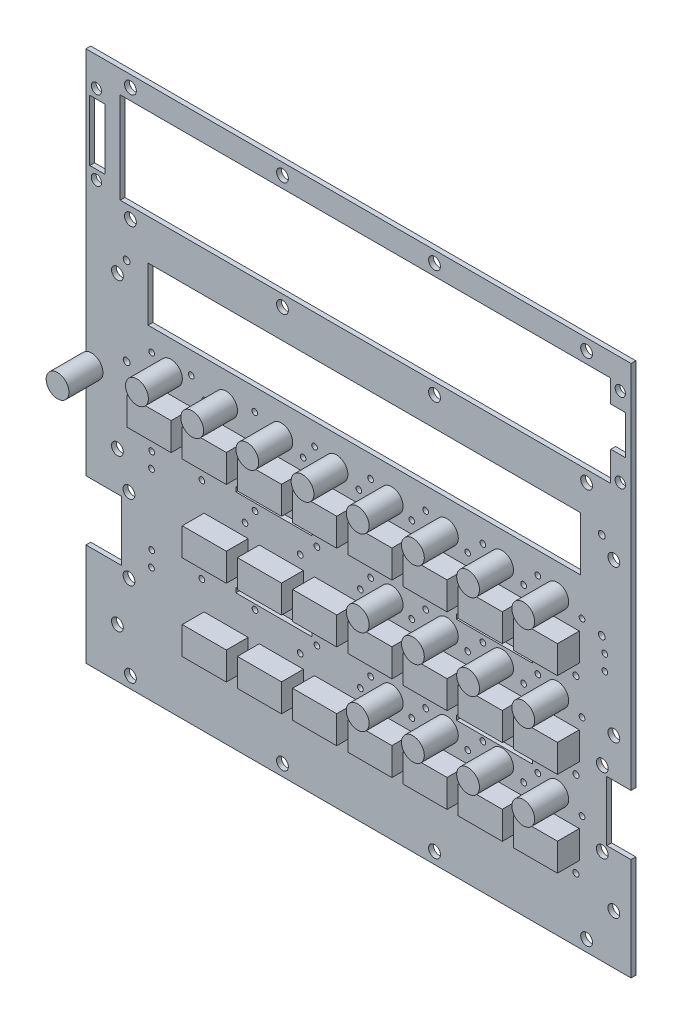
from build123d import *

# Parameters (mm, degrees)
SKETCH1_W                       = 144.56156
SKETCH1_H                       = 18.00098
SKETCH1_W_2                     = 5.08
SKETCH1_H_2                     = 20.32
SKETCH1_W_3                     = 25.4
SKETCH1_H_3                     = 1.5875
BOARD_DEPTH                     = 1.592072
SKETCH2_R                       = 3.81
LED_KINGBRIGHT_3P_2P54_1_DEPTH  = 11.3538
SKETCH3_R                       = 3.81
LED_KINGBRIGHT_3P_2P54_2_DEPTH  = 11.3538
SKETCH4_R                       = 3.81
LED_KINGBRIGHT_3P_2P54_3_DEPTH  = 11.3538
SKETCH5_R                       = 3.81
LED_KINGBRIGHT_3P_2P54_4_DEPTH  = 11.3538
SKETCH6_R                       = 3.81
LED_KINGBRIGHT_3P_2P54_5_DEPTH  = 11.3538
SKETCH7_R                       = 3.81
LED_KINGBRIGHT_3P_2P54_6_DEPTH  = 11.3538
SKETCH8_R                       = 3.81
LED_KINGBRIGHT_3P_2P54_7_DEPTH  = 11.3538
SKETCH9_R                       = 3.81
LED_KINGBRIGHT_3P_2P54_8_DEPTH  = 11.3538
SKETCH10_R                      = 3.81
LED_KINGBRIGHT_3P_2P54_9_DEPTH  = 11.3538
SKETCH19_R                      = 3.81
LED_KINGBRIGHT_3P_2P54_18_DEPTH = 11.3538
SKETCH20_R                      = 3.81
LED_KINGBRIGHT_3P_2P54_19_DEPTH = 11.3538
SKETCH21_R                      = 3.81
LED_KINGBRIGHT_3P_2P54_20_DEPTH = 11.3538
SKETCH22_R                      = 3.81
LED_KINGBRIGHT_3P_2P54_21_DEPTH = 11.3538
SKETCH23_R                      = 3.81
LED_KINGBRIGHT_3P_2P54_22_DEPTH = 11.3538
SKETCH24_R                      = 3.81
LED_KINGBRIGHT_3P_2P54_23_DEPTH = 11.3538
SKETCH25_R                      = 3.81
LED_KINGBRIGHT_3P_2P54_24_DEPTH = 11.3538
SKETCH26_R                      = 3.81
LED_KINGBRIGHT_3P_2P54_25_DEPTH = 11.3538
SKETCH27_W                      = 14.732
SKETCH27_H                      = 9.271
SWITCH_MCDTS2_1_DEPTH           = 7.3000108
SKETCH28_W                      = 14.732
SKETCH28_H                      = 9.271
SWITCH_MCDTS2_2_DEPTH           = 7.3000108
SKETCH29_W                      = 14.732
SKETCH29_H                      = 9.271
SWITCH_MCDTS2_3_DEPTH           = 7.3000108
SKETCH30_W                      = 14.732
SKETCH30_H                      = 9.271
SWITCH_MCDTS2_4_DEPTH           = 7.3000108
SKETCH31_W                      = 14.732
SKETCH31_H                      = 9.271
SWITCH_MCDTS2_5_DEPTH           = 7.3000108
SKETCH32_W                      = 14.732
SKETCH32_H                      = 9.271
SWITCH_MCDTS2_6_DEPTH           = 7.3000108
SKETCH33_W                      = 14.732
SKETCH33_H                      = 9.271
SWITCH_MCDTS2_7_DEPTH           = 7.3000108
SKETCH34_W                      = 14.732
SKETCH34_H                      = 9.271
SWITCH_MCDTS2_8_DEPTH           = 7.3000108
SKETCH36_W                      = 14.732
SKETCH36_H                      = 9.271
SWITCH_MCDTS2_10_DEPTH          = 7.3000108
SKETCH37_W                      = 14.732
SKETCH37_H                      = 9.271
SWITCH_MCDTS2_11_DEPTH          = 7.3000108
SKETCH38_W                      = 14.732
SKETCH38_H                      = 9.271
SWITCH_MCDTS2_12_DEPTH          = 7.3000108
SKETCH39_W                      = 14.732
SKETCH39_H                      = 9.271
SWITCH_MCDTS2_13_DEPTH          = 7.3000108
SKETCH40_W                      = 14.732
SKETCH40_H                      = 9.271
SWITCH_MCDTS2_14_DEPTH          = 7.3000108
SKETCH41_W                      = 14.732
SKETCH41_H                      = 9.271
SWITCH_MCDTS2_15_DEPTH          = 7.3000108
SKETCH43_W                      = 14.732
SKETCH43_H                      = 9.271
SWITCH_MCDTS2_17_DEPTH          = 7.3000108
SKETCH44_W                      = 14.732
SKETCH44_H                      = 9.271
SWITCH_MCDTS2_18_DEPTH          = 7.3000108
SKETCH45_W                      = 14.732
SKETCH45_H                      = 9.271
SWITCH_MCDTS2_19_DEPTH          = 7.3000108
SKETCH46_W                      = 14.732
SKETCH46_H                      = 9.271
SWITCH_MCDTS2_20_DEPTH          = 7.3000108
SKETCH47_W                      = 14.732
SKETCH47_H                      = 9.271
SWITCH_MCDTS2_21_DEPTH          = 7.3000108
SKETCH48_W                      = 14.732
SKETCH48_H                      = 9.271
SWITCH_MCDTS2_22_DEPTH          = 7.3000108
SKETCH49_W                      = 14.732
SKETCH49_H                      = 9.271
SWITCH_MCDTS2_23_DEPTH          = 7.3000108
SKETCH50_W                      = 14.732
SKETCH50_H                      = 9.271
SWITCH_MCDTS2_24_DEPTH          = 7.3000108
SKETCH56_R                      = 1.016
SKETCH56_R_2                    = 0.9652
SKETCH56_R_3                    = 0.9525
SKETCH56_R_4                    = 1.9685
SKETCH56_R_5                    = 1.1303
SKETCH56_R_6                    = 1.7145
CUT_EXTRUDE1_DEPTH              = 10


with BuildPart() as part:
    # Sketch1 → BOARD (new body)
    with BuildSketch(Plane.XY):
        Polygon((0, 0), (182.118, 0), (182.118, 34.24682), (173.98746, 34.24682), (173.98746, 54.24678), (182.118, 54.24678), (182.118, 177.8), (0, 177.8), (0, 54.24678), (11.86942, 54.24678), (11.86942, 34.24682), (0, 34.24682), align=None)
        with Locations((93.01988, 117.17909)):
            Rectangle(SKETCH1_W, SKETCH1_H, mode=Mode.SUBTRACT)
        with Locations((3.81, 154.813)):
            Rectangle(SKETCH1_W_2, SKETCH1_H_2, mode=Mode.SUBTRACT)
        Polygon((12.7, 170.18), (175.26, 170.18), (175.26, 162.6616), (180.086, 162.6616), (180.2892, 162.4584), (180.2892, 149.606), (175.3616, 149.606), (175.26, 149.5044), (175.26, 139.7), (12.7, 139.7), (11.43, 139.7), (11.43, 170.18), align=None, mode=Mode.SUBTRACT)
        with Locations((62.7634, 46.20895)):
            Rectangle(SKETCH1_W_3, SKETCH1_H_3, mode=Mode.SUBTRACT)
        with Locations((136.5134176, 46.20895)):
            Rectangle(SKETCH1_W_3, SKETCH1_H_3, mode=Mode.SUBTRACT)
        with Locations((136.5134176, 75.41895)):
            Rectangle(SKETCH1_W_3, SKETCH1_H_3, mode=Mode.SUBTRACT)
        with Locations((62.7634, 75.41895)):
            Rectangle(SKETCH1_W_3, SKETCH1_H_3, mode=Mode.SUBTRACT)
    extrude(amount=BOARD_DEPTH)

    # Sketch56 → Cut-Extrude1 (cut)
    with BuildSketch(Plane.XY.offset(1.592072)):
        with Locations((163.703, 21.1074)):
            Circle(SKETCH56_R)
        with Locations((163.703, 49.6824)):
            Circle(SKETCH56_R)
        with Locations((145.2626, 21.8186)):
            Circle(SKETCH56_R_2)
        with Locations((126.8476, 21.6154)):
            Circle(SKETCH56_R_2)
        with Locations((108.4072, 21.7424)):
            Circle(SKETCH56_R_2)
        with Locations((89.9668, 21.844)):
            Circle(SKETCH56_R_2)
        with Locations((71.5264, 20.7772)):
            Circle(SKETCH56_R_2)
        with Locations((53.086, 21.1582)):
            Circle(SKETCH56_R_2)
        with Locations((34.6472002, 21.1328)):
            Circle(SKETCH56_R)
        with Locations((145.2626, 49.5554)):
            Circle(SKETCH56_R)
        with Locations((126.8222, 49.3522)):
            Circle(SKETCH56_R)
        with Locations((108.3818, 49.1236)):
            Circle(SKETCH56_R)
        with Locations((89.9414, 49.6824)):
            Circle(SKETCH56_R)
        with Locations((71.501, 49.1998)):
            Circle(SKETCH56_R)
        with Locations((53.0606, 49.1998)):
            Circle(SKETCH56_R)
        with Locations((34.6202, 49.276)):
            Circle(SKETCH56_R)
        with Locations((163.703, 78.2574)):
            Circle(SKETCH56_R)
        with Locations((145.2626, 77.7748)):
            Circle(SKETCH56_R)
        with Locations((126.746, 78.3336)):
            Circle(SKETCH56_R)
        with Locations((108.3818, 78.74)):
            Circle(SKETCH56_R)
        with Locations((89.9414, 78.3336)):
            Circle(SKETCH56_R)
        with Locations((71.501, 78.2574)):
            Circle(SKETCH56_R)
        with Locations((53.0606, 78.4098)):
            Circle(SKETCH56_R)
        with Locations((34.6202, 78.0542)):
            Circle(SKETCH56_R)
        with Locations((91.694, 38.6588)):
            Circle(SKETCH56_R_3)
        with Locations((77.1652, 43.7388)):
            Circle(SKETCH56_R_3)
        with Locations((71.5772, 38.6588)):
            Circle(SKETCH56_R_3)
        with Locations((56.4896, 43.7388)):
            Circle(SKETCH56_R_3)
        with Locations((38.735, 43.7388)):
            Circle(SKETCH56_R_3)
        with Locations((21.8948, 38.6588)):
            Circle(SKETCH56_R_3)
        with Locations((21.971, 43.7388)):
            Circle(SKETCH56_R_3)
        with Locations((77.1652, 72.3138)):
            Circle(SKETCH56_R_3)
        with Locations((91.694, 67.2338)):
            Circle(SKETCH56_R_3)
        with Locations((71.5772, 67.2338)):
            Circle(SKETCH56_R_3)
        with Locations((56.4896, 72.3138)):
            Circle(SKETCH56_R_3)
        with Locations((53.1368, 67.2338)):
            Circle(SKETCH56_R_3)
        with Locations((38.735, 72.3138)):
            Circle(SKETCH56_R_3)
        with Locations((21.8948, 67.2338)):
            Circle(SKETCH56_R_3)
        with Locations((21.971, 72.3138)):
            Circle(SKETCH56_R_3)
        with Locations((165.735, 95.8088)):
            Circle(SKETCH56_R_3)
        with Locations((150.9776, 100.8888)):
            Circle(SKETCH56_R_3)
        with Locations((146.2278, 95.8088)):
            Circle(SKETCH56_R_3)
        with Locations((132.6134, 100.8888)):
            Circle(SKETCH56_R_3)
        with Locations((113.4872, 100.8888)):
            Circle(SKETCH56_R_3)
        with Locations((127.508, 95.8088)):
            Circle(SKETCH56_R_3)
        with Locations((108.8644, 95.8088)):
            Circle(SKETCH56_R_3)
        with Locations((95.0976, 100.8888)):
            Circle(SKETCH56_R_3)
        with Locations((91.186, 95.8088)):
            Circle(SKETCH56_R_3)
        with Locations((76.3778, 100.8888)):
            Circle(SKETCH56_R_3)
        with Locations((72.5424, 95.8088)):
            Circle(SKETCH56_R_3)
        with Locations((56.4134, 100.8888)):
            Circle(SKETCH56_R_3)
        with Locations((39.7256, 95.8088)):
            Circle(SKETCH56_R_3)
        with Locations((35.179, 100.8888)):
            Circle(SKETCH56_R_3)
        with Locations((24.2062, 95.8088)):
            Circle(SKETCH56_R_3)
        with Locations((21.971, 100.8888)):
            Circle(SKETCH56_R_3)
        with Locations((132.6134, 72.3138)):
            Circle(SKETCH56_R_3)
        with Locations((146.2278, 67.2338)):
            Circle(SKETCH56_R_3)
        with Locations((113.4872, 72.3138)):
            Circle(SKETCH56_R_3)
        with Locations((127.508, 67.2338)):
            Circle(SKETCH56_R_3)
        with Locations((95.0976, 72.3138)):
            Circle(SKETCH56_R_3)
        with Locations((108.8644, 67.2338)):
            Circle(SKETCH56_R_3)
        with Locations((150.9776, 43.7388)):
            Circle(SKETCH56_R_3)
        with Locations((132.6134, 43.7388)):
            Circle(SKETCH56_R_3)
        with Locations((113.4872, 43.7388)):
            Circle(SKETCH56_R_3)
        with Locations((95.0976, 43.7388)):
            Circle(SKETCH56_R_3)
        with Locations((108.8644, 38.6588)):
            Circle(SKETCH56_R_3)
        with Locations((150.9776, 72.3138)):
            Circle(SKETCH56_R_3)
        with Locations((165.735, 67.2338)):
            Circle(SKETCH56_R_3)
        with Locations((173.3296, 89.4588)):
            Circle(SKETCH56_R_3)
        with Locations((173.355, 84.3534)):
            Circle(SKETCH56_R_3)
        with Locations((176.37252, 118.11)):
            Circle(SKETCH56_R_4)
        with Locations((176.37252, 67.31)):
            Circle(SKETCH56_R_4)
        with Locations((176.37252, 16.51)):
            Circle(SKETCH56_R_4)
        with Locations((167.259, 135.89)):
            Circle(SKETCH56_R_4)
        with Locations((116.459, 135.89)):
            Circle(SKETCH56_R_4)
        with Locations((65.659, 135.89)):
            Circle(SKETCH56_R_4)
        with Locations((14.859, 135.89)):
            Circle(SKETCH56_R_4)
        with Locations((10.51052, 118.11)):
            Circle(SKETCH56_R_4)
        with Locations((10.51052, 67.31)):
            Circle(SKETCH56_R_4)
        with Locations((10.51052, 16.51)):
            Circle(SKETCH56_R_4)
        with Locations((165.735, 38.6588)):
            Circle(SKETCH56_R_3)
        with Locations((146.2278, 38.6588)):
            Circle(SKETCH56_R_3)
        with Locations((127.508, 38.6588)):
            Circle(SKETCH56_R_3)
        with Locations((14.859, 173.99)):
            Circle(SKETCH56_R_4)
        with Locations((65.659, 173.99)):
            Circle(SKETCH56_R_4)
        with Locations((116.459, 173.99)):
            Circle(SKETCH56_R_4)
        with Locations((167.259, 173.99)):
            Circle(SKETCH56_R_4)
        with Locations((167.259, 3.81)):
            Circle(SKETCH56_R_4)
        with Locations((116.459, 3.81)):
            Circle(SKETCH56_R_4)
        with Locations((65.659, 3.81)):
            Circle(SKETCH56_R_4)
        with Locations((14.859, 3.81)):
            Circle(SKETCH56_R_4)
        with Locations((172.50664, 56.7436)):
            Circle(SKETCH56_R_4)
        with Locations((172.50664, 31.75)):
            Circle(SKETCH56_R_4)
        with Locations((14.36878, 56.7436)):
            Circle(SKETCH56_R_4)
        with Locations((14.36878, 31.75)):
            Circle(SKETCH56_R_4)
        with Locations((172.34154, 123.37542)):
            Circle(SKETCH56_R_5)
        with Locations((172.34154, 94.16542)):
            Circle(SKETCH56_R_5)
        with Locations((13.59154, 94.16542)):
            Circle(SKETCH56_R_5)
        with Locations((13.59154, 123.37542)):
            Circle(SKETCH56_R_5)
        with Locations((178.51374, 141.56182)):
            Circle(SKETCH56_R_6)
        with Locations((178.51374, 168.06164)):
            Circle(SKETCH56_R_6)
        with Locations((3.50012, 168.06164)):
            Circle(SKETCH56_R_6)
        with Locations((3.50012, 141.56182)):
            Circle(SKETCH56_R_6)
    extrude(amount=-CUT_EXTRUDE1_DEPTH, mode=Mode.SUBTRACT)


with BuildPart() as body_2:
    # Sketch2 → LED-KINGBRIGHT_3P_2P54-1 (new body)
    with BuildSketch(Plane.XY.offset(1.592072)):
        with Locations((1.86944, 86.9188)):
            Circle(SKETCH2_R)
    extrude(amount=LED_KINGBRIGHT_3P_2P54_1_DEPTH)


with BuildPart() as body_3:
    # Sketch3 → LED-KINGBRIGHT_3P_2P54-2 (new body)
    with BuildSketch(Plane.XY.offset(1.592072)):
        with Locations((157.4597054, 41.1988)):
            Circle(SKETCH3_R)
    extrude(amount=LED_KINGBRIGHT_3P_2P54_2_DEPTH)


with BuildPart() as body_4:
    # Sketch4 → LED-KINGBRIGHT_3P_2P54-3 (new body)
    with BuildSketch(Plane.XY.offset(1.592072)):
        with Locations((139.022201, 41.1988)):
            Circle(SKETCH4_R)
    extrude(amount=LED_KINGBRIGHT_3P_2P54_3_DEPTH)


with BuildPart() as body_5:
    # Sketch5 → LED-KINGBRIGHT_3P_2P54-4 (new body)
    with BuildSketch(Plane.XY.offset(1.592072)):
        with Locations((120.5846966, 41.1988)):
            Circle(SKETCH5_R)
    extrude(amount=LED_KINGBRIGHT_3P_2P54_4_DEPTH)


with BuildPart() as body_6:
    # Sketch6 → LED-KINGBRIGHT_3P_2P54-5 (new body)
    with BuildSketch(Plane.XY.offset(1.592072)):
        with Locations((102.1472176, 41.1988)):
            Circle(SKETCH6_R)
    extrude(amount=LED_KINGBRIGHT_3P_2P54_5_DEPTH)


with BuildPart() as body_7:
    # Sketch7 → LED-KINGBRIGHT_3P_2P54-6 (new body)
    with BuildSketch(Plane.XY.offset(1.592072)):
        with Locations((157.4597308, 69.7738)):
            Circle(SKETCH7_R)
    extrude(amount=LED_KINGBRIGHT_3P_2P54_6_DEPTH)


with BuildPart() as body_8:
    # Sketch8 → LED-KINGBRIGHT_3P_2P54-7 (new body)
    with BuildSketch(Plane.XY.offset(1.592072)):
        with Locations((139.0222264, 69.7738)):
            Circle(SKETCH8_R)
    extrude(amount=LED_KINGBRIGHT_3P_2P54_7_DEPTH)


with BuildPart() as body_9:
    # Sketch9 → LED-KINGBRIGHT_3P_2P54-8 (new body)
    with BuildSketch(Plane.XY.offset(1.592072)):
        with Locations((120.584722, 69.7738)):
            Circle(SKETCH9_R)
    extrude(amount=LED_KINGBRIGHT_3P_2P54_8_DEPTH)


with BuildPart() as body_10:
    # Sketch10 → LED-KINGBRIGHT_3P_2P54-9 (new body)
    with BuildSketch(Plane.XY.offset(1.592072)):
        with Locations((102.1472176, 69.7738)):
            Circle(SKETCH10_R)
    extrude(amount=LED_KINGBRIGHT_3P_2P54_9_DEPTH)


with BuildPart() as body_11:
    # Sketch19 → LED-KINGBRIGHT_3P_2P54-18 (new body)
    with BuildSketch(Plane.XY.offset(1.592072)):
        with Locations((157.4597308, 98.3488)):
            Circle(SKETCH19_R)
    extrude(amount=LED_KINGBRIGHT_3P_2P54_18_DEPTH)


with BuildPart() as body_12:
    # Sketch20 → LED-KINGBRIGHT_3P_2P54-19 (new body)
    with BuildSketch(Plane.XY.offset(1.592072)):
        with Locations((139.0222264, 98.3488)):
            Circle(SKETCH20_R)
    extrude(amount=LED_KINGBRIGHT_3P_2P54_19_DEPTH)


with BuildPart() as body_13:
    # Sketch21 → LED-KINGBRIGHT_3P_2P54-20 (new body)
    with BuildSketch(Plane.XY.offset(1.592072)):
        with Locations((120.584722, 98.3488)):
            Circle(SKETCH21_R)
    extrude(amount=LED_KINGBRIGHT_3P_2P54_20_DEPTH)


with BuildPart() as body_14:
    # Sketch22 → LED-KINGBRIGHT_3P_2P54-21 (new body)
    with BuildSketch(Plane.XY.offset(1.592072)):
        with Locations((102.1472176, 98.3488)):
            Circle(SKETCH22_R)
    extrude(amount=LED_KINGBRIGHT_3P_2P54_21_DEPTH)


with BuildPart() as body_15:
    # Sketch23 → LED-KINGBRIGHT_3P_2P54-22 (new body)
    with BuildSketch(Plane.XY.offset(1.592072)):
        with Locations((83.7097132, 98.3488)):
            Circle(SKETCH23_R)
    extrude(amount=LED_KINGBRIGHT_3P_2P54_22_DEPTH)


with BuildPart() as body_16:
    # Sketch24 → LED-KINGBRIGHT_3P_2P54-23 (new body)
    with BuildSketch(Plane.XY.offset(1.592072)):
        with Locations((65.2722088, 98.3488)):
            Circle(SKETCH24_R)
    extrude(amount=LED_KINGBRIGHT_3P_2P54_23_DEPTH)


with BuildPart() as body_17:
    # Sketch25 → LED-KINGBRIGHT_3P_2P54-24 (new body)
    with BuildSketch(Plane.XY.offset(1.592072)):
        with Locations((46.8347044, 98.3488)):
            Circle(SKETCH25_R)
    extrude(amount=LED_KINGBRIGHT_3P_2P54_24_DEPTH)


with BuildPart() as body_18:
    # Sketch26 → LED-KINGBRIGHT_3P_2P54-25 (new body)
    with BuildSketch(Plane.XY.offset(1.592072)):
        with Locations((28.3972, 98.3488)):
            Circle(SKETCH26_R)
    extrude(amount=LED_KINGBRIGHT_3P_2P54_25_DEPTH)


with BuildPart() as body_19:
    # Sketch27 → SWITCH-MCDTS2-1 (new body)
    with BuildSketch(Plane.XY.offset(1.592072)):
        with Locations((157.4597308, 29.9593)):
            Rectangle(SKETCH27_W, SKETCH27_H)
    extrude(amount=SWITCH_MCDTS2_1_DEPTH)


with BuildPart() as body_20:
    # Sketch28 → SWITCH-MCDTS2-2 (new body)
    with BuildSketch(Plane.XY.offset(1.592072)):
        with Locations((157.4597308, 58.5343)):
            Rectangle(SKETCH28_W, SKETCH28_H)
    extrude(amount=SWITCH_MCDTS2_2_DEPTH)


with BuildPart() as body_21:
    # Sketch29 → SWITCH-MCDTS2-3 (new body)
    with BuildSketch(Plane.XY.offset(1.592072)):
        with Locations((139.0222264, 29.9593)):
            Rectangle(SKETCH29_W, SKETCH29_H)
    extrude(amount=SWITCH_MCDTS2_3_DEPTH)


with BuildPart() as body_22:
    # Sketch30 → SWITCH-MCDTS2-4 (new body)
    with BuildSketch(Plane.XY.offset(1.592072)):
        with Locations((120.584722, 29.9593)):
            Rectangle(SKETCH30_W, SKETCH30_H)
    extrude(amount=SWITCH_MCDTS2_4_DEPTH)


with BuildPart() as body_23:
    # Sketch31 → SWITCH-MCDTS2-5 (new body)
    with BuildSketch(Plane.XY.offset(1.592072)):
        with Locations((102.1472176, 29.9593)):
            Rectangle(SKETCH31_W, SKETCH31_H)
    extrude(amount=SWITCH_MCDTS2_5_DEPTH)


with BuildPart() as body_24:
    # Sketch32 → SWITCH-MCDTS2-6 (new body)
    with BuildSketch(Plane.XY.offset(1.592072)):
        with Locations((83.7097132, 29.9593)):
            Rectangle(SKETCH32_W, SKETCH32_H)
    extrude(amount=SWITCH_MCDTS2_6_DEPTH)


with BuildPart() as body_25:
    # Sketch33 → SWITCH-MCDTS2-7 (new body)
    with BuildSketch(Plane.XY.offset(1.592072)):
        with Locations((65.2722088, 29.9593)):
            Rectangle(SKETCH33_W, SKETCH33_H)
    extrude(amount=SWITCH_MCDTS2_7_DEPTH)


with BuildPart() as body_26:
    # Sketch34 → SWITCH-MCDTS2-8 (new body)
    with BuildSketch(Plane.XY.offset(1.592072)):
        with Locations((46.8347044, 29.9593)):
            Rectangle(SKETCH34_W, SKETCH34_H)
    extrude(amount=SWITCH_MCDTS2_8_DEPTH)


with BuildPart() as body_27:
    # Sketch36 → SWITCH-MCDTS2-10 (new body)
    with BuildSketch(Plane.XY.offset(1.592072)):
        with Locations((139.0222264, 58.5343)):
            Rectangle(SKETCH36_W, SKETCH36_H)
    extrude(amount=SWITCH_MCDTS2_10_DEPTH)


with BuildPart() as body_28:
    # Sketch37 → SWITCH-MCDTS2-11 (new body)
    with BuildSketch(Plane.XY.offset(1.592072)):
        with Locations((120.584722, 58.5343)):
            Rectangle(SKETCH37_W, SKETCH37_H)
    extrude(amount=SWITCH_MCDTS2_11_DEPTH)


with BuildPart() as body_29:
    # Sketch38 → SWITCH-MCDTS2-12 (new body)
    with BuildSketch(Plane.XY.offset(1.592072)):
        with Locations((102.1472176, 58.5343)):
            Rectangle(SKETCH38_W, SKETCH38_H)
    extrude(amount=SWITCH_MCDTS2_12_DEPTH)


with BuildPart() as body_30:
    # Sketch39 → SWITCH-MCDTS2-13 (new body)
    with BuildSketch(Plane.XY.offset(1.592072)):
        with Locations((83.7097132, 58.5343)):
            Rectangle(SKETCH39_W, SKETCH39_H)
    extrude(amount=SWITCH_MCDTS2_13_DEPTH)


with BuildPart() as body_31:
    # Sketch40 → SWITCH-MCDTS2-14 (new body)
    with BuildSketch(Plane.XY.offset(1.592072)):
        with Locations((65.2722088, 58.5343)):
            Rectangle(SKETCH40_W, SKETCH40_H)
    extrude(amount=SWITCH_MCDTS2_14_DEPTH)


with BuildPart() as body_32:
    # Sketch41 → SWITCH-MCDTS2-15 (new body)
    with BuildSketch(Plane.XY.offset(1.592072)):
        with Locations((46.8347044, 58.5343)):
            Rectangle(SKETCH41_W, SKETCH41_H)
    extrude(amount=SWITCH_MCDTS2_15_DEPTH)


with BuildPart() as body_33:
    # Sketch43 → SWITCH-MCDTS2-17 (new body)
    with BuildSketch(Plane.XY.offset(1.592072)):
        with Locations((157.4597308, 87.1093)):
            Rectangle(SKETCH43_W, SKETCH43_H)
    extrude(amount=SWITCH_MCDTS2_17_DEPTH)


with BuildPart() as body_34:
    # Sketch44 → SWITCH-MCDTS2-18 (new body)
    with BuildSketch(Plane.XY.offset(1.592072)):
        with Locations((139.0222264, 87.1093)):
            Rectangle(SKETCH44_W, SKETCH44_H)
    extrude(amount=SWITCH_MCDTS2_18_DEPTH)


with BuildPart() as body_35:
    # Sketch45 → SWITCH-MCDTS2-19 (new body)
    with BuildSketch(Plane.XY.offset(1.592072)):
        with Locations((120.584722, 87.1093)):
            Rectangle(SKETCH45_W, SKETCH45_H)
    extrude(amount=SWITCH_MCDTS2_19_DEPTH)


with BuildPart() as body_36:
    # Sketch46 → SWITCH-MCDTS2-20 (new body)
    with BuildSketch(Plane.XY.offset(1.592072)):
        with Locations((102.1472176, 87.1093)):
            Rectangle(SKETCH46_W, SKETCH46_H)
    extrude(amount=SWITCH_MCDTS2_20_DEPTH)


with BuildPart() as body_37:
    # Sketch47 → SWITCH-MCDTS2-21 (new body)
    with BuildSketch(Plane.XY.offset(1.592072)):
        with Locations((83.7097132, 87.1093)):
            Rectangle(SKETCH47_W, SKETCH47_H)
    extrude(amount=SWITCH_MCDTS2_21_DEPTH)


with BuildPart() as body_38:
    # Sketch48 → SWITCH-MCDTS2-22 (new body)
    with BuildSketch(Plane.XY.offset(1.592072)):
        with Locations((65.2722088, 87.1093)):
            Rectangle(SKETCH48_W, SKETCH48_H)
    extrude(amount=SWITCH_MCDTS2_22_DEPTH)


with BuildPart() as body_39:
    # Sketch49 → SWITCH-MCDTS2-23 (new body)
    with BuildSketch(Plane.XY.offset(1.592072)):
        with Locations((46.8347044, 87.1093)):
            Rectangle(SKETCH49_W, SKETCH49_H)
    extrude(amount=SWITCH_MCDTS2_23_DEPTH)


with BuildPart() as body_40:
    # Sketch50 → SWITCH-MCDTS2-24 (new body)
    with BuildSketch(Plane.XY.offset(1.592072)):
        with Locations((28.3972, 87.1093)):
            Rectangle(SKETCH50_W, SKETCH50_H)
    extrude(amount=SWITCH_MCDTS2_24_DEPTH)


solid = Compound([part.part, body_2.part, body_3.part, body_4.part, body_5.part, body_6.part, body_7.part, body_8.part, body_9.part, body_10.part, body_11.part, body_12.part, body_13.part, body_14.part, body_15.part, body_16.part, body_17.part, body_18.part, body_19.part, body_20.part, body_21.part, body_22.part, body_23.part, body_24.part, body_25.part, body_26.part, body_27.part, body_28.part, body_29.part, body_30.part, body_31.part, body_32.part, body_33.part, body_34.part, body_35.part, body_36.part, body_37.part, body_38.part, body_39.part, body_40.part])
